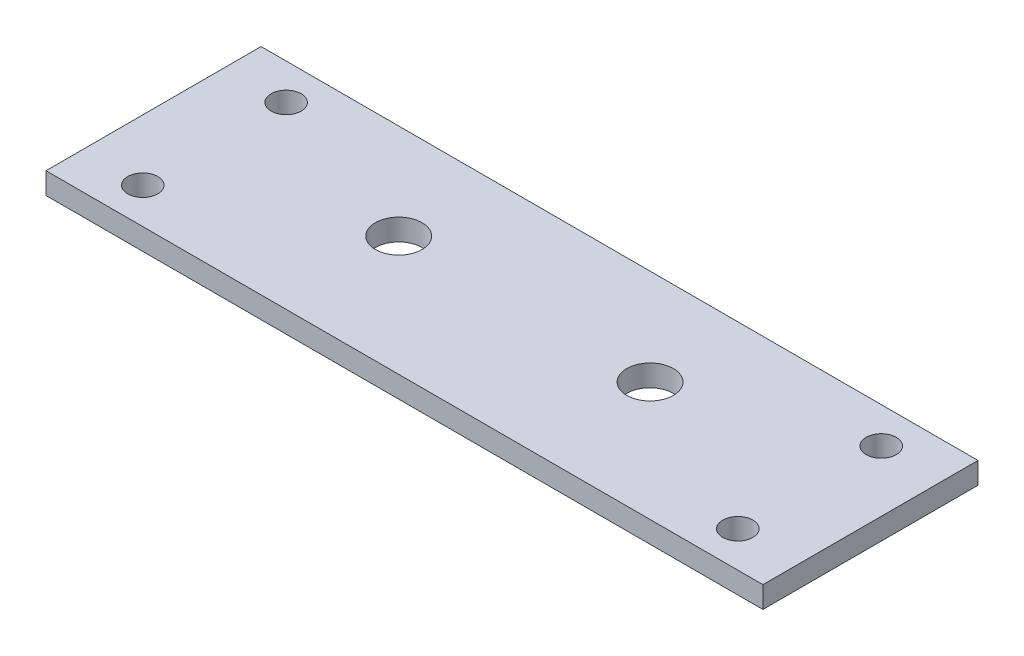
from build123d import *

# Parameters (mm, degrees)
SKETCH1_W           = 100
SKETCH1_H           = 30
SKETCH1_R           = 2.1
SKETCH1_R_2         = 3.25
BOSS_EXTRUDE1_DEPTH = 3


with BuildPart() as part:
    # Sketch1 → Boss-Extrude1 (new body)
    with BuildSketch(Plane(origin=(0, 0, 0), x_dir=(1, 0, 0), z_dir=(0, 1, 0))):
        with Locations((9.209266856, -1.60968661)):
            Rectangle(SKETCH1_W, SKETCH1_H)
        with Locations(Location((50.709266856, 8.39031339, 0), (0, 0, 270))):
            Circle(SKETCH1_R, mode=Mode.SUBTRACT)
        with Locations(Location((50.709266856, -11.60968661, 0), (0, 0, 90))):
            Circle(SKETCH1_R, mode=Mode.SUBTRACT)
        with Locations(Location((-32.290733144, 8.39031339, 0), (0, 0, 90))):
            Circle(SKETCH1_R, mode=Mode.SUBTRACT)
        with Locations(Location((-32.290733144, -11.60968661, 0), (0, 0, 270))):
            Circle(SKETCH1_R, mode=Mode.SUBTRACT)
        with Locations(Location((-8.290733144, 0.09031339, 0), (0, 0, 270))):
            Circle(SKETCH1_R_2, mode=Mode.SUBTRACT)
        with Locations(Location((26.859621674, 0, 0), (0, 0, 270))):
            Circle(SKETCH1_R_2, mode=Mode.SUBTRACT)
    extrude(amount=BOSS_EXTRUDE1_DEPTH)


solid = part.part
